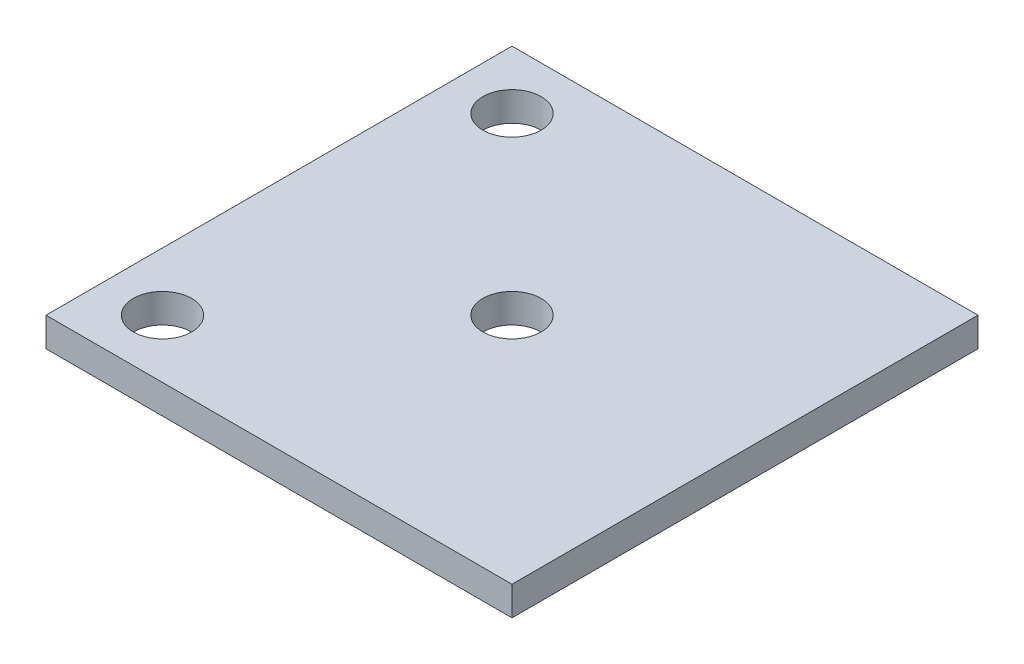
from build123d import *

# Parameters (mm, degrees)
SKETCH1_W           = 50.8
SKETCH1_H           = 50.8
BOSS_EXTRUDE1_DEPTH = 3.175
SKETCH2_R           = 3.175
CUT_EXTRUDE1_DEPTH  = 3.175


with BuildPart() as part:
    # Sketch1 → Boss-Extrude1 (new body)
    with BuildSketch(Plane(origin=(0, 0, 0), x_dir=(1, 0, 0), z_dir=(0, 1, 0))):
        with Locations((25.4, 25.4)):
            Rectangle(SKETCH1_W, SKETCH1_H)
    extrude(amount=BOSS_EXTRUDE1_DEPTH)

    # Sketch2 → Cut-Extrude1 (cut)
    with BuildSketch(Plane(origin=(0, 3.175, 0), x_dir=(1, 0, 0), z_dir=(0, 1, 0))):
        with Locations(Location((6.35, 44.45, 0), (0, 0, 270))):
            Circle(SKETCH2_R)
        with Locations(Location((6.35, 6.35, 0), (0, 0, 270))):
            Circle(SKETCH2_R)
        with Locations(Location((25.4, 25.4, 0), (0, 0, 270))):
            Circle(SKETCH2_R)
    extrude(amount=-CUT_EXTRUDE1_DEPTH, mode=Mode.SUBTRACT)


solid = part.part
